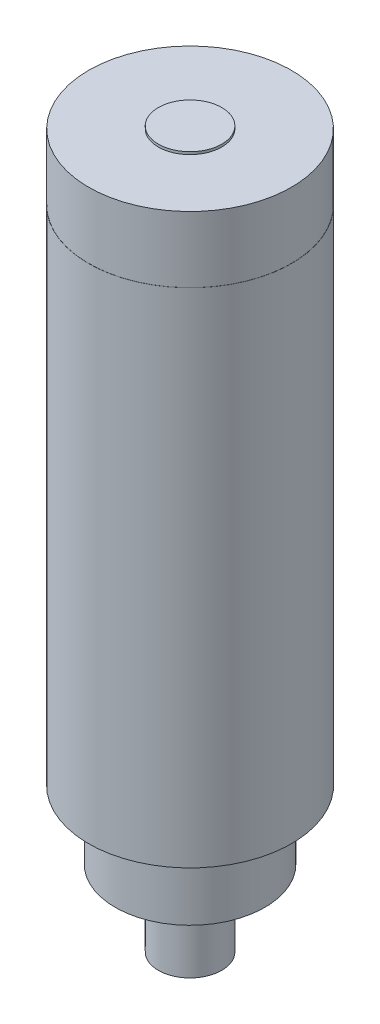
from build123d import *


with BuildPart() as part:
    # Esquisse2 → Révolution1 (revolve)
    with BuildSketch(Plane.XY, mode=Mode.PRIVATE) as r_volution1_sk:
        Polygon((0, 0), (12.5, 0), (12.5, 30), (29.5, 30), (29.5, 57), (40, 57), (40, 255), (39.95, 255), (39.95, 281), (12.5, 281), (12.5, 282), (0, 282), align=None)
    revolve(r_volution1_sk.sketch.rotate(Axis((0, 282, 0), (0, -1, 0)), 180), axis=Axis((0, 282, 0), (0, -1, 0)))


solid = part.part
